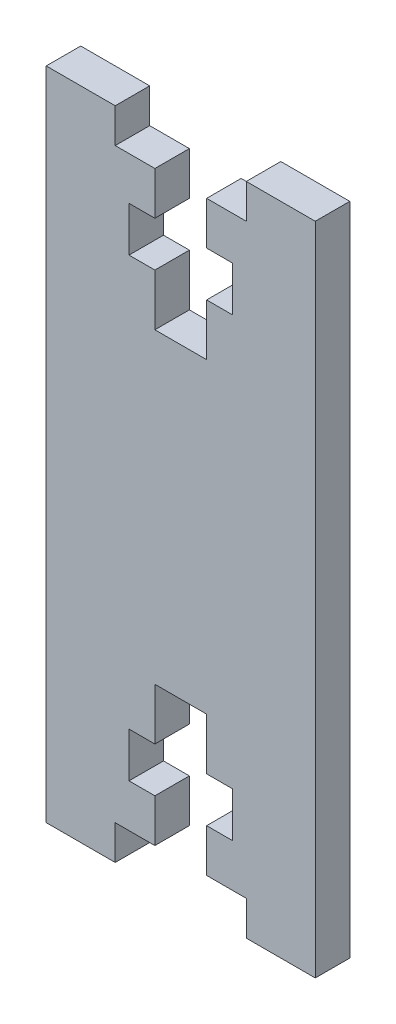
from build123d import *

# Parameters (mm, degrees)
EXTRUDE_1_DEPTH = 2


with BuildPart() as part:
    # 草图2 → 凸台-拉伸1 (new body)
    with BuildSketch(Plane.XY):
        Polygon((5.8, -27.5), (5.8, -29.5), (9.8, -29.5), (9.8, 8.5), (5.8, 8.5), (5.8, 6.5), (3.5, 6.5), (3.5, 4), (5, 4), (5, 1.4), (3.5, 1.4), (3.5, -1.6), (0.5, -1.6), (0.5, 1.4), (-1, 1.4), (-1, 4), (0.5, 4), (0.5, 6.5), (-1.8, 6.5), (-1.8, 8.5), (-5.8, 8.5), (-5.8, -29.5), (-1.8, -29.5), (-1.8, -27.5), (0.5, -27.5), (0.5, -25), (-1, -25), (-1, -22.4), (0.5, -22.4), (0.5, -19.4), (3.5, -19.4), (3.5, -22.4), (5, -22.4), (5, -25), (3.5, -25), (3.5, -27.5), align=None)
    extrude(amount=EXTRUDE_1_DEPTH)


solid = part.part
